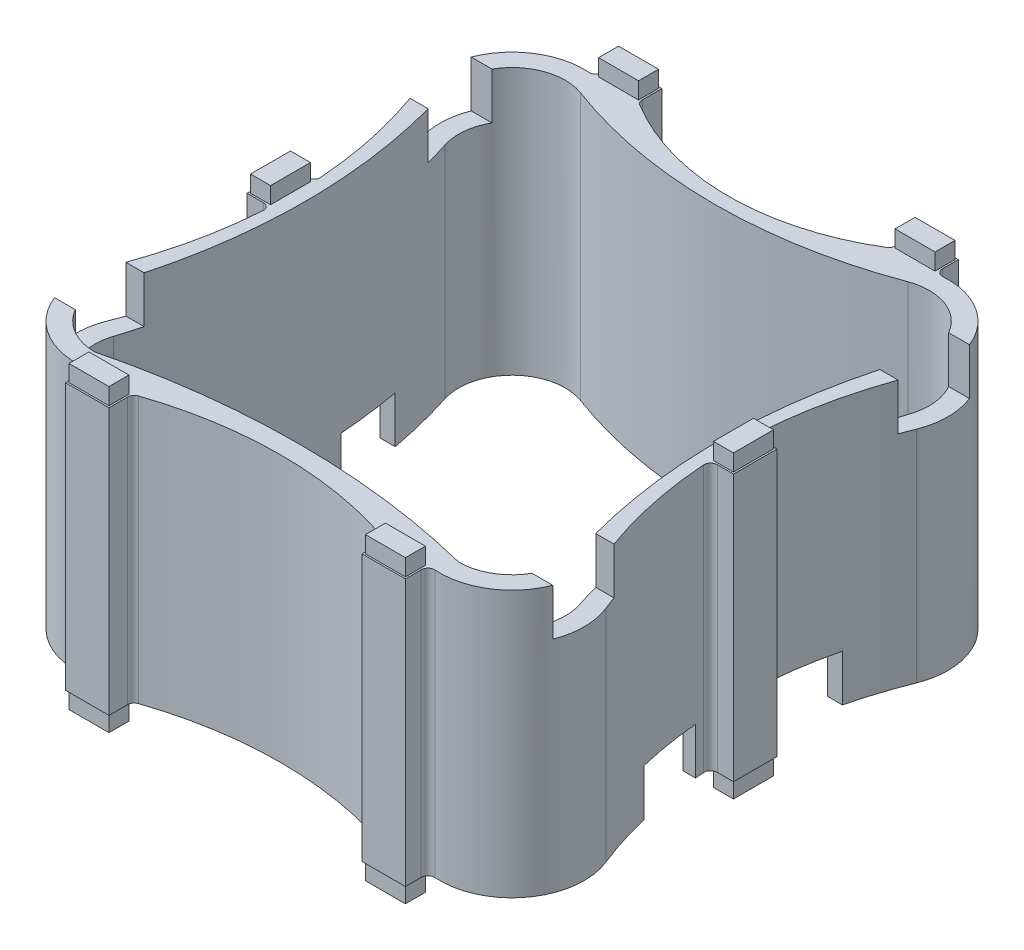
from build123d import *

# Parameters (mm, degrees)
EXTRUDE_1_DEPTH        = 40
SKETCH_5_W             = 3
SKETCH_5_H             = 6
SKETCH_5_W_2           = 6
SKETCH_5_H_2           = 3
EXTRUDE_3_DEPTH        = 2.5
SKETCH_6_W             = 6
SKETCH_6_H             = 3
SKETCH_6_W_2           = 3
SKETCH_6_H_2           = 6
EXTRUDE_4_DEPTH        = 2.5
FILLET_1_R             = 1
CUT_EXTRUDE_8754_DEPTH = 7
CUT_EXTRUDE_START      = -7
CUT_EXTRUDE_9199_DEPTH = 7


with BuildPart() as part:
    # 草图2 → 凸台-拉伸1 (new body)
    with BuildSketch(Plane(origin=(0, 0, 0), x_dir=(1, 0, 0), z_dir=(0, 1, 0))):
        with BuildLine():
            Line((-33, 3.25), (-36.5, 3.25))
            Line((-36.5, 3.25), (-36.5, -3.25))
            Line((-36.5, -3.25), (-33, -3.25))
            ThreePointArc((-33, -3.25), (-34.3699608, -13.457697281), (-37.384420147, -23.305890579))
            ThreePointArc((-37.384420147, -23.305890579), (-35.741677738, -34.13030337), (-25.5, -38))
            Line((-25.5, -38), (-25.5, -41.5))
            Line((-25.5, -41.5), (-19, -41.5))
            Line((-19, -41.5), (-19, -38))
            ThreePointArc((-19, -38), (0, -34.737686486), (19, -38))
            Line((19, -38), (19, -41.5))
            Line((19, -41.5), (25.5, -41.5))
            Line((25.5, -41.5), (25.5, -38))
            ThreePointArc((25.5, -38), (35.741677738, -34.13030337), (37.384420147, -23.305890579))
            ThreePointArc((37.384420147, -23.305890579), (34.3699608, -13.457697281), (33, -3.25))
            Line((33, -3.25), (36.5, -3.25))
            Line((36.5, -3.25), (36.5, 3.25))
            Line((36.5, 3.25), (33, 3.25))
            ThreePointArc((33, 3.25), (34.3699608, 13.457697281), (37.384420147, 23.305890579))
            ThreePointArc((37.384420147, 23.305890579), (35.741677738, 34.13030337), (25.5, 38))
            Line((25.5, 38), (25.5, 41.5))
            Line((25.5, 41.5), (19, 41.5))
            Line((19, 41.5), (19, 38))
            ThreePointArc((19, 38), (0, 32.48661644), (-19, 38))
            Line((-19, 38), (-19, 41.5))
            Line((-19, 41.5), (-25.5, 41.5))
            Line((-25.5, 41.5), (-25.5, 38))
            ThreePointArc((-25.5, 38), (-35.741677738, 34.13030337), (-37.384420147, 23.305890579))
            ThreePointArc((-37.384420147, 23.305890579), (-34.3699608, 13.457697281), (-33, 3.25))
        make_face()
        with BuildLine():
            ThreePointArc((-24.584159113, 34.841334273), (-32.862117731, 33.087897358), (-34.944211337, 24.886432483))
            ThreePointArc((-34.944211337, 24.886432483), (-31.079757149, 0), (-34.944211337, -24.886432483))
            ThreePointArc((-34.944211337, -24.886432483), (-33.784066651, -32.031796166), (-27.335670062, -35.32122458))
            ThreePointArc((-27.335670062, -35.32122458), (0, -31.93514908), (27.335670062, -35.32122458))
            ThreePointArc((27.335670062, -35.32122458), (33.784066651, -32.031796166), (34.944211337, -24.886432483))
            ThreePointArc((34.944211337, -24.886432483), (31.079757149, 0), (34.944211337, 24.886432483))
            ThreePointArc((34.944211337, 24.886432483), (32.862117731, 33.087897358), (24.584159113, 34.841334273))
            ThreePointArc((24.584159113, 34.841334273), (0, 30.397281148), (-24.584159113, 34.841334273))
        make_face(mode=Mode.SUBTRACT)
    extrude(amount=-EXTRUDE_1_DEPTH)

    # 草图5 → 凸台-拉伸3 (add)
    with BuildSketch(Plane(origin=(0, 0, 0), x_dir=(1, 0, 0), z_dir=(0, 1, 0))):
        with Locations((-34.75, 0)):
            Rectangle(SKETCH_5_W, SKETCH_5_H)
        with Locations((-22.25, -39.75)):
            Rectangle(SKETCH_5_W_2, SKETCH_5_H_2)
        with Locations((-22.25, 39.75)):
            Rectangle(SKETCH_5_W_2, SKETCH_5_H_2)
        with Locations((22.25, 39.75)):
            Rectangle(SKETCH_5_W_2, SKETCH_5_H_2)
        with Locations((22.25, -39.75)):
            Rectangle(SKETCH_5_W_2, SKETCH_5_H_2)
        with Locations((34.75, 0)):
            Rectangle(SKETCH_5_W, SKETCH_5_H)
    extrude(amount=EXTRUDE_3_DEPTH)

    # 草图6 → 凸台-拉伸4 (add)
    with BuildSketch(Plane.XZ.offset(40)):
        with Locations((-22.25, 39.75)):
            Rectangle(SKETCH_6_W, SKETCH_6_H)
        with Locations((-34.75, 0)):
            Rectangle(SKETCH_6_W_2, SKETCH_6_H_2)
        with Locations((-22.25, -39.75)):
            Rectangle(SKETCH_6_W, SKETCH_6_H)
        with Locations((22.25, 39.75)):
            Rectangle(SKETCH_6_W, SKETCH_6_H)
        with Locations((22.25, -39.75)):
            Rectangle(SKETCH_6_W, SKETCH_6_H)
        with Locations((34.75, 0)):
            Rectangle(SKETCH_6_W_2, SKETCH_6_H_2)
    extrude(amount=EXTRUDE_4_DEPTH)

    # 圆角1
    fillet_1_edges = [part.edges().sort_by_distance(p)[0] for p in [
        (-25.5, -20, -38),
        (-19, -20, -38),
        (19, -20, -38),
        (25.5, -20, -38),
        (33, -20, -3.25),
        (33, -20, 3.25),
        (25.5, -20, 38),
        (19, -20, 38),
        (-19, -20, 38),
        (-25.5, -20, 38),
        (-33, -20, 3.25),
        (-33, -20, -3.25),
    ]]
    fillet(fillet_1_edges, radius=FILLET_1_R)

    # 草图7 → Cut-Extrude 8754 (cut)
    with BuildSketch(Plane(origin=(0, 0, 0), x_dir=(1, 0, 0), z_dir=(0, 1, 0))):
        with BuildLine():
            Line((-36.633725749, -21.323718343), (-33.898557891, -21.323718343))
            ThreePointArc((-33.898557891, -21.323718343), (-34.401232724, -23.110989975), (-34.944211337, -24.886432483))
            ThreePointArc((-34.944211337, -24.886432483), (-35.274550553, -28.150449442), (-34.273344825, -31.274632183))
            Line((-34.273344825, -31.274632183), (-37.421883074, -31.274632183))
            ThreePointArc((-37.421883074, -31.274632183), (-38.165581654, -27.580951917), (-37.605977079, -23.854934713))
            ThreePointArc((-37.605977079, -23.854934713), (-37.106234952, -22.594556671), (-36.633725749, -21.323718343))
        make_face()
        with BuildLine():
            Line((36.633725749, -21.323718343), (33.898557891, -21.323718343))
            ThreePointArc((33.898557891, -21.323718343), (34.401232724, -23.110989975), (34.944211337, -24.886432483))
            ThreePointArc((34.944211337, -24.886432483), (35.274550553, -28.150449442), (34.273344825, -31.274632183))
            Line((34.273344825, -31.274632183), (37.421883074, -31.274632183))
            ThreePointArc((37.421883074, -31.274632183), (38.165581654, -27.580951917), (37.605977079, -23.854934713))
            ThreePointArc((37.605977079, -23.854934713), (37.106234952, -22.594556671), (36.633725749, -21.323718343))
        make_face()
        with BuildLine():
            Line((-36.633725749, 21.323718343), (-33.898557891, 21.323718343))
            ThreePointArc((-33.898557891, 21.323718343), (-34.401232724, 23.110989975), (-34.944211337, 24.886432483))
            ThreePointArc((-34.944211337, 24.886432483), (-35.274550553, 28.150449442), (-34.273344825, 31.274632183))
            Line((-34.273344825, 31.274632183), (-37.421883074, 31.274632183))
            ThreePointArc((-37.421883074, 31.274632183), (-38.165581654, 27.580951917), (-37.605977079, 23.854934713))
            ThreePointArc((-37.605977079, 23.854934713), (-37.106234952, 22.594556671), (-36.633725749, 21.323718343))
        make_face()
        with BuildLine():
            Line((37.421883074, 31.274632183), (34.273344825, 31.274632183))
            ThreePointArc((34.273344825, 31.274632183), (35.274550553, 28.150449442), (34.944211337, 24.886432483))
            ThreePointArc((34.944211337, 24.886432483), (34.401232724, 23.110989975), (33.898557891, 21.323718343))
            Line((33.898557891, 21.323718343), (36.633725749, 21.323718343))
            ThreePointArc((36.633725749, 21.323718343), (37.106234952, 22.594556671), (37.605977079, 23.854934713))
            ThreePointArc((37.605977079, 23.854934713), (38.165581654, 27.580951917), (37.421883074, 31.274632183))
        make_face()
    extrude(amount=-CUT_EXTRUDE_8754_DEPTH, mode=Mode.SUBTRACT)

    # 草图8 → Cut-Extrude 9199 (cut)
    with BuildSketch(Plane.XZ.offset(40).offset(CUT_EXTRUDE_START)):
        with BuildLine():
            Line((-33.167247328, -5.619996041), (-31.272419616, -5.619996041))
            ThreePointArc((-31.272419616, -5.619996041), (-31.726152882, -10.279804399), (-32.444885624, -14.906154046))
            Line((-32.444885624, -14.906154046), (-34.704557814, -14.906154046))
            ThreePointArc((-34.704557814, -14.906154046), (-33.762273508, -10.291819093), (-33.167247328, -5.619996041))
        make_face()
        with BuildLine():
            Line((-34.704557814, 14.906154046), (-32.444885624, 14.906154046))
            ThreePointArc((-32.444885624, 14.906154046), (-31.726152882, 10.279804399), (-31.272419616, 5.619996041))
            Line((-31.272419616, 5.619996041), (-33.167247328, 5.619996041))
            ThreePointArc((-33.167247328, 5.619996041), (-33.762273508, 10.291819093), (-34.704557814, 14.906154046))
        make_face()
        with BuildLine():
            Line((33.167247328, -5.619996041), (31.272419616, -5.619996041))
            ThreePointArc((31.272419616, -5.619996041), (31.726152882, -10.279804399), (32.444885624, -14.906154046))
            Line((32.444885624, -14.906154046), (34.704557814, -14.906154046))
            ThreePointArc((34.704557814, -14.906154046), (33.762273508, -10.291819093), (33.167247328, -5.619996041))
        make_face()
        with BuildLine():
            Line((33.167247328, 5.619996041), (31.272419616, 5.619996041))
            ThreePointArc((31.272419616, 5.619996041), (31.726152882, 10.279804399), (32.444885624, 14.906154046))
            Line((32.444885624, 14.906154046), (34.704557814, 14.906154046))
            ThreePointArc((34.704557814, 14.906154046), (33.762273508, 10.291819093), (33.167247328, 5.619996041))
        make_face()
    extrude(amount=CUT_EXTRUDE_9199_DEPTH, mode=Mode.SUBTRACT)


solid = part.part
